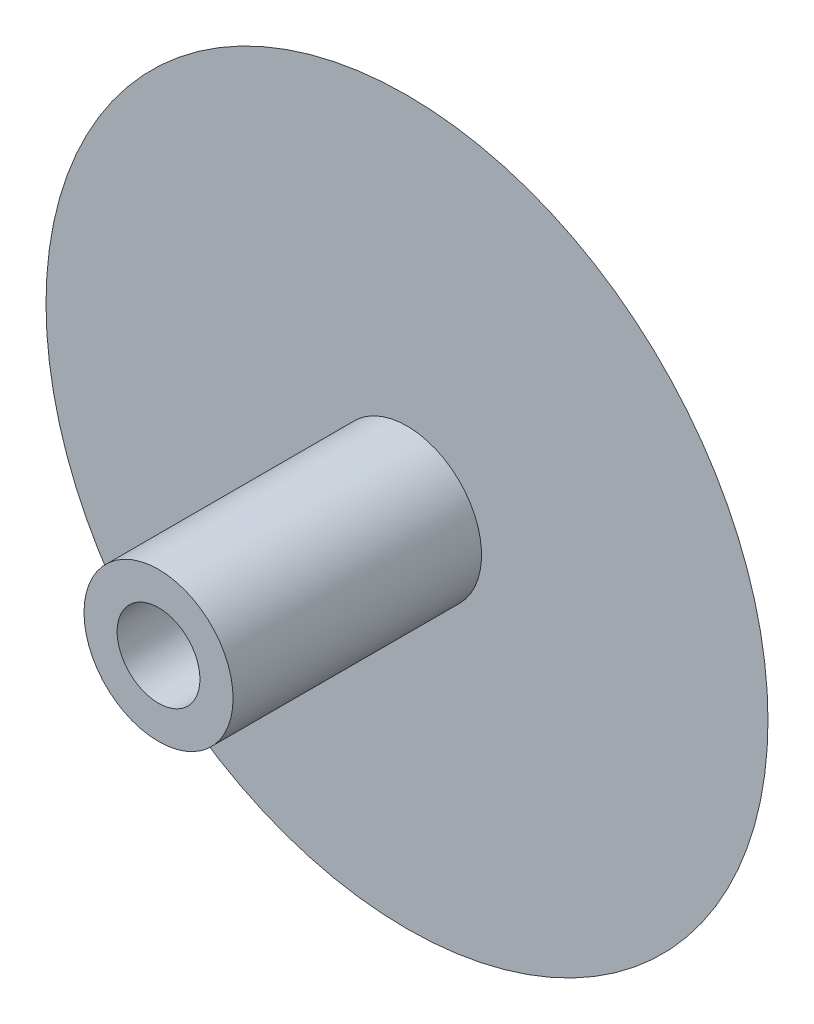
from build123d import *

# Parameters (mm, degrees)
SKETCH_2_R      = 4.5
SKETCH_2_R_2    = 2.5
EXTRUDE_1_DEPTH = 15


with BuildPart() as part:
    # 草圖1 → 旋轉1 (revolve)
    with BuildSketch(Plane(origin=(0, 0, 0), x_dir=(1, 0, 0), z_dir=(0, 1, 0))):
        with BuildLine():
            Line((21.794494718, 45), (0, 45))
            Line((0, 45), (0, 50))
            ThreePointArc((0, 50), (11.180339887, 48.733971724), (21.794494718, 45))
        make_face()
    revolve(axis=Axis((0, 0, -121.094346888), (0, 0, 1)))

    # 草圖2 → 填料-伸長1 (add)
    with BuildSketch(Plane.XY.offset(-45)):
        with Locations(Location((0, 0, 0), (0, 0, 180))):
            Circle(SKETCH_2_R)
        Circle(SKETCH_2_R_2, mode=Mode.SUBTRACT)
    extrude(amount=EXTRUDE_1_DEPTH)


solid = part.part
